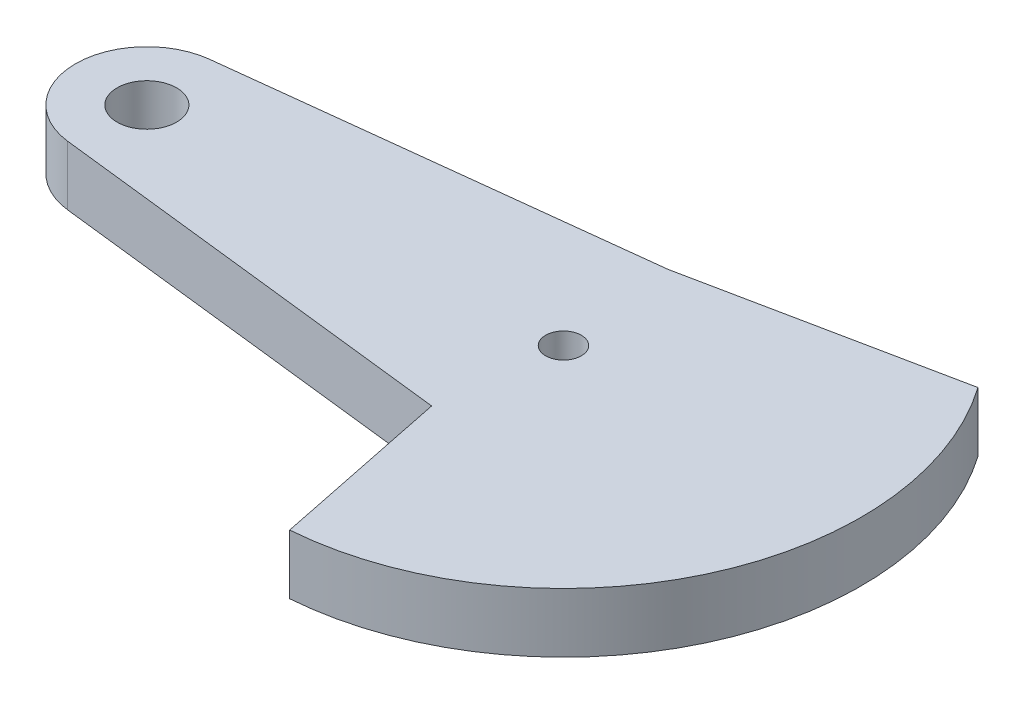
from build123d import *

# Parameters (mm, degrees)
ESQUISSE2_R        = 1.5
ESQUISSE2_R_2      = 2.5
BOSS_EXTRU_1_DEPTH = 5


with BuildPart() as part:
    # Esquisse2 → Boss.-Extru.1 (new body)
    with BuildSketch(Plane.XZ.offset(38.8)):
        with BuildLine():
            Line((8.857142857, -0.065520771), (-25.685714286, -4.039312463))
            ThreePointArc((-25.685714286, -4.039312463), (-31, -10), (-25.685714286, -15.960687537))
            Line((-25.685714286, -15.960687537), (8.857142857, -19.934479229))
            Line((8.857142857, -19.934479229), (30.467410963, -24.355663986))
            ThreePointArc((30.467410963, -24.355663986), (32.607632, 0.67215889), (11.924183808, 14.92584034))
            Line((11.924183808, 14.92584034), (8.857142857, -0.065520771))
        make_face()
        with Locations(Location((10, -10, 0), (0, 0, 270))):
            Circle(ESQUISSE2_R, mode=Mode.SUBTRACT)
        with Locations(Location((-25, -10, 0), (0, 0, 270))):
            Circle(ESQUISSE2_R_2, mode=Mode.SUBTRACT)
    extrude(amount=BOSS_EXTRU_1_DEPTH)


solid = part.part
